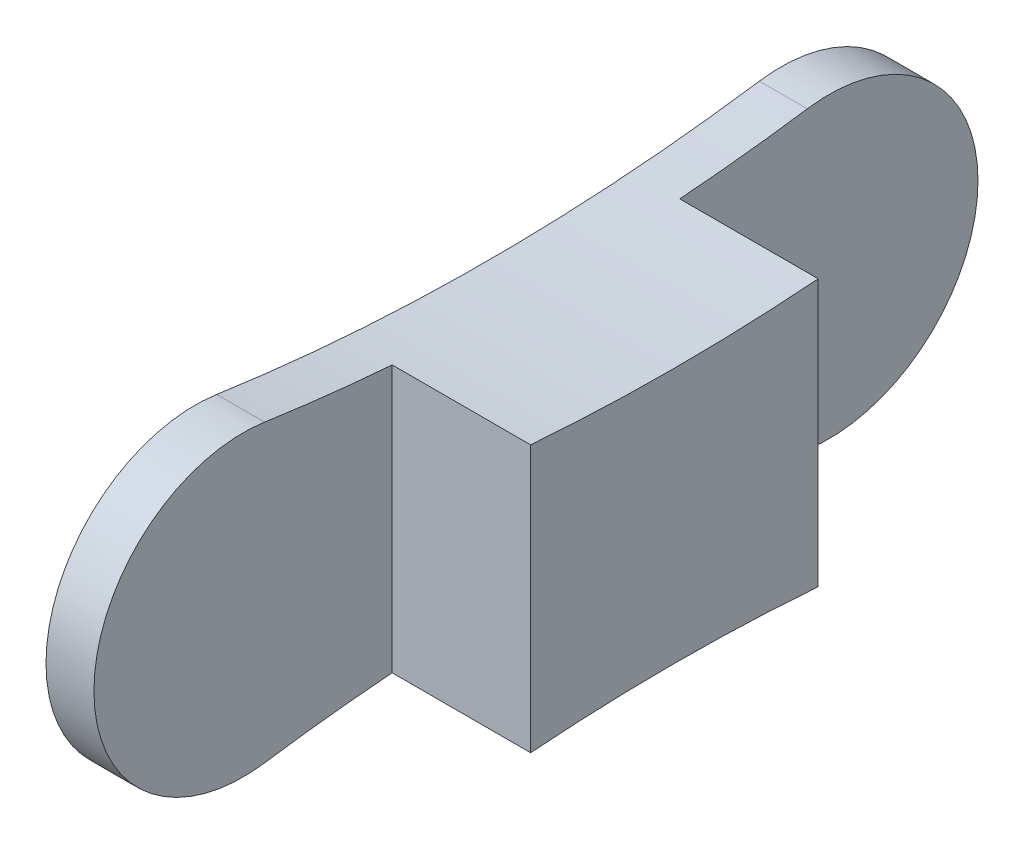
from build123d import *

# Parameters (mm, degrees)
BOSS_EXTRUDE1_DEPTH     = 35
CUT_EXTRUDE1_DEPTH      = 146.0965196
CUT_EXTRUDE1_DEPTH_BACK = 146.0965196
SKETCH4_W               = 52
SKETCH4_H               = 56


with BuildPart() as part:
    # Sketch1 → Boss-Extrude1 (new body)
    with BuildSketch(Plane(origin=(0, 0, 0), x_dir=(0, 0, -1), z_dir=(1, 0, 0))):
        with BuildLine():
            ThreePointArc((-4.051298915, 27.705360079), (-21.182969216, 18.310702204), (-28, 0))
            Line((-28, 0), (28, 0))
            ThreePointArc((28, 0), (18.310702204, 21.182969216), (-4.051298915, 27.705360079))
        make_face()
        with BuildLine():
            Line((28, 0), (-28, 0))
            ThreePointArc((-28, 0), (-21.182969216, -18.310702204), (-4.051298915, -27.705360079))
            ThreePointArc((-4.051298915, -27.705360079), (18.310702204, -21.182969216), (28, 0))
        make_face()
        with BuildLine():
            ThreePointArc((-105.948701085, 27.705360079), (-88.817030784, 18.310702204), (-82, 0))
            Line((-82, 0), (-28, 0))
            ThreePointArc((-28, 0), (-21.182969216, 18.310702204), (-4.051298915, 27.705360079))
            ThreePointArc((-4.051298915, 27.705360079), (-55, 24), (-105.948701085, 27.705360079))
        make_face()
        with BuildLine():
            Line((-28, 0), (-82, 0))
            ThreePointArc((-82, 0), (-88.817030784, -18.310702204), (-105.948701085, -27.705360079))
            ThreePointArc((-105.948701085, -27.705360079), (-55, -24), (-4.051298915, -27.705360079))
            ThreePointArc((-4.051298915, -27.705360079), (-21.182969216, -18.310702204), (-28, 0))
        make_face()
        with BuildLine():
            ThreePointArc((-105.948701085, 27.705360079), (-128.310702204, 21.182969216), (-138, 0))
            Line((-138, 0), (-82, 0))
            ThreePointArc((-82, 0), (-88.817030784, 18.310702204), (-105.948701085, 27.705360079))
        make_face()
        with BuildLine():
            Line((-82, 0), (-138, 0))
            ThreePointArc((-138, 0), (-128.310702204, -21.182969216), (-105.948701085, -27.705360079))
            ThreePointArc((-105.948701085, -27.705360079), (-88.817030784, -18.310702204), (-82, 0))
        make_face()
    extrude(amount=BOSS_EXTRUDE1_DEPTH)

    # Sketch4 → Cut-Extrude1 (cut, two sides: drawn at the far end of the back side and taken through both)
    with BuildSketch(Plane(origin=(0, 0, 0), x_dir=(1, 0, 0), z_dir=(0, 1, 0)).offset(-CUT_EXTRUDE1_DEPTH_BACK)):
        with Locations((35, 0)):
            Rectangle(SKETCH4_W, SKETCH4_H)
        with Locations((35, -110)):
            Rectangle(SKETCH4_W, SKETCH4_H)
    extrude(amount=CUT_EXTRUDE1_DEPTH + CUT_EXTRUDE1_DEPTH_BACK, mode=Mode.SUBTRACT)


solid = part.part
